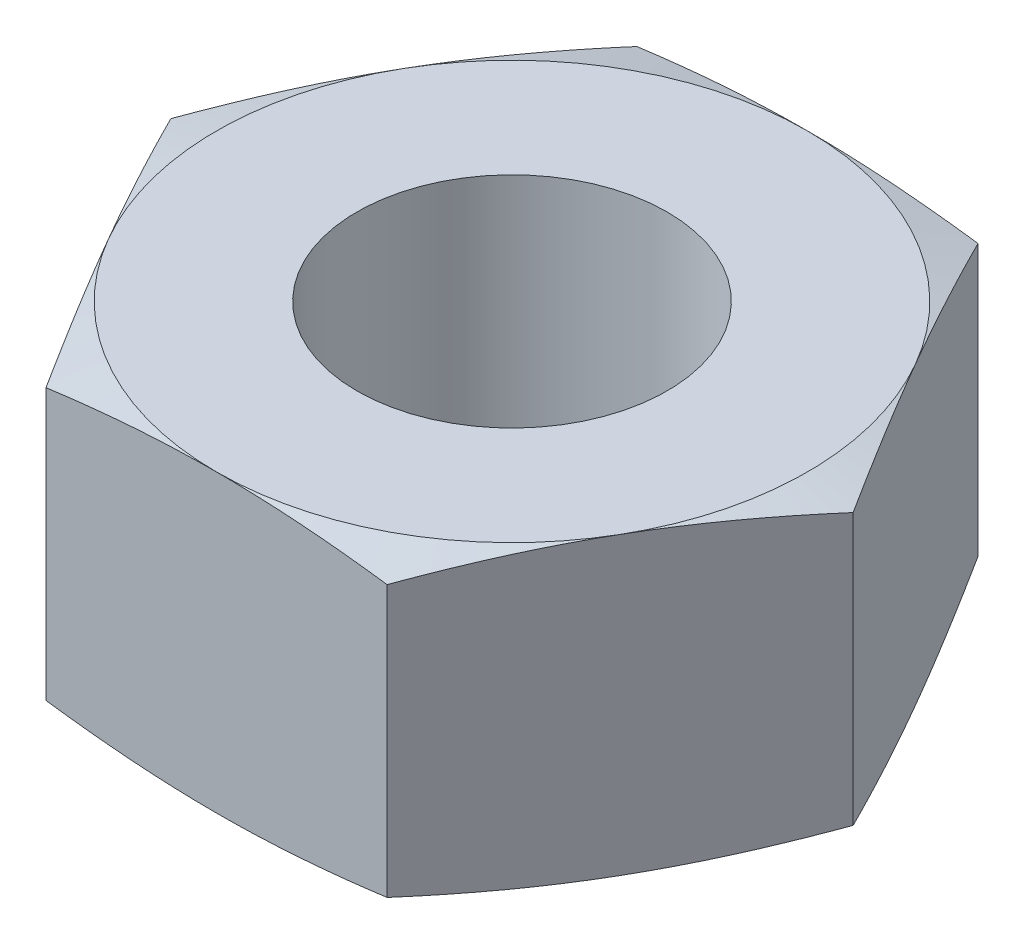
from build123d import *

# Parameters (mm, degrees)
EXTRUDE_1_DEPTH    = 4
HOLE_WIZARD_M5_1_D = 4.2


with BuildPart() as part:
    # 草图1 → 凸台-拉伸1 (new body)
    with BuildSketch(Plane(origin=(0, 0, 0), x_dir=(1, 0, 0), z_dir=(0, 1, 0))):
        Polygon((4.618802154, 0), (2.309401077, 4), (-2.309401077, 4), (-4.618802154, 0), (-2.309401077, -4), (2.309401077, -4), align=None)
    extrude(amount=EXTRUDE_1_DEPTH)

    # M5 螺纹孔1 (through all)
    with Locations(Plane(origin=(0, 4, 0), x_dir=(1, 0, 0), z_dir=(0, 1, 0))):
        with Locations((0, 0)):
            Hole(HOLE_WIZARD_M5_1_D / 2)

    # 草图4 → 切除-旋转1 (revolve, cut)
    with BuildSketch(Plane(origin=(0, 0, 0), x_dir=(0, 0, -1), z_dir=(1, 0, 0)), mode=Mode.PRIVATE) as cut_revolve_1_sk:
        Polygon((4, 4), (5.578280707, 3.577100959), (4.847725581, 6.644234984), align=None)
        Polygon((4.847725581, -2.644234984), (4, 0), (5.578280707, 0.422899041), align=None)
    revolve(cut_revolve_1_sk.sketch.rotate(Axis((0, 0, 0), (0, -1, 0)), 180), axis=Axis((0, 0, 0), (0, -1, 0)), mode=Mode.SUBTRACT)


solid = part.part
